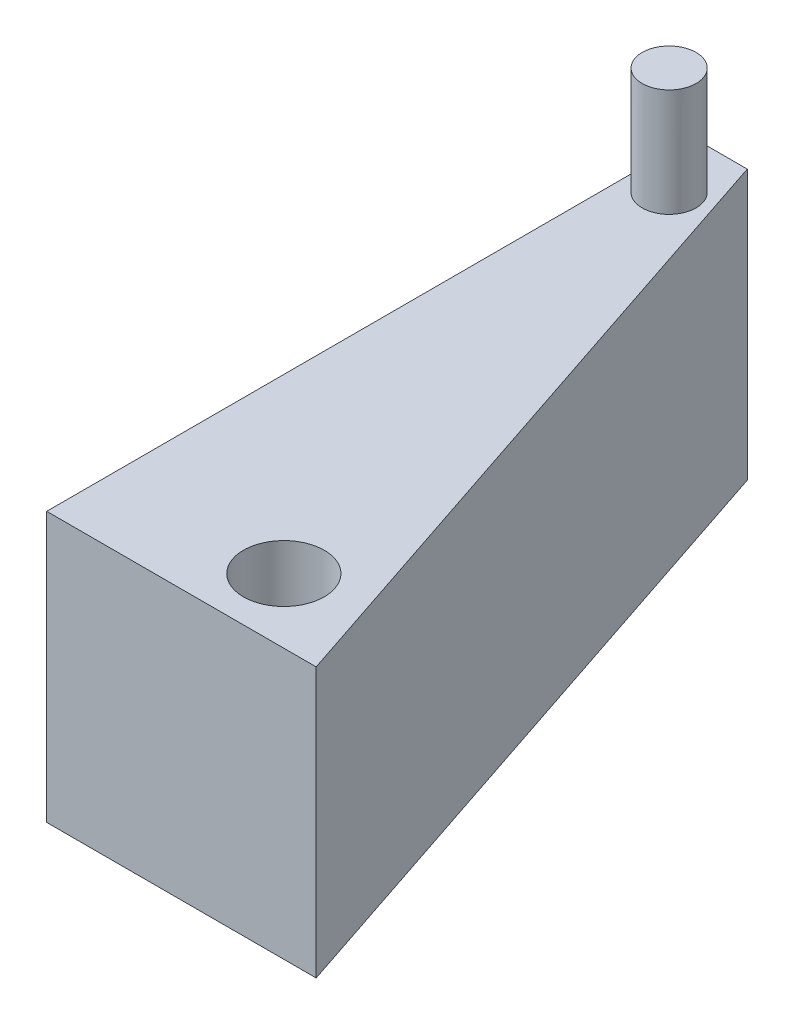
from build123d import *

# Parameters (mm, degrees)
BOSS_EXTRUDE1_DEPTH = 31.75
SKETCH2_R           = 4.7625
CUT_EXTRUDE2_DEPTH  = 89.44526556
SKETCH3_R           = 3.175
BOSS_EXTRUDE2_DEPTH = 12.7


with BuildPart() as part:
    # Sketch1 → Boss-Extrude1 (new body)
    with BuildSketch(Plane(origin=(0, 0, 0), x_dir=(1, 0, 0), z_dir=(0, 1, 0))):
        Polygon((0, 0), (0, 76.2), (6.35, 76.2), (31.75, 0), align=None)
    extrude(amount=BOSS_EXTRUDE1_DEPTH)

    # Sketch2 → Cut-Extrude2 (cut, through all)
    with BuildSketch(Plane(origin=(0, 31.75, 0), x_dir=(1, 0, 0), z_dir=(0, 1, 0))):
        with Locations(Location((20.32, 7.62, 0), (0, 0, 270))):
            Circle(SKETCH2_R)
    extrude(amount=-CUT_EXTRUDE2_DEPTH, mode=Mode.SUBTRACT)

    # Sketch3 → Boss-Extrude2 (add)
    with BuildSketch(Plane(origin=(0, 31.75, 0), x_dir=(1, 0, 0), z_dir=(0, 1, 0))):
        with Locations(Location((4.1275, 69.215, 0), (0, 0, 90))):
            Circle(SKETCH3_R)
    extrude(amount=BOSS_EXTRUDE2_DEPTH)


solid = part.part
